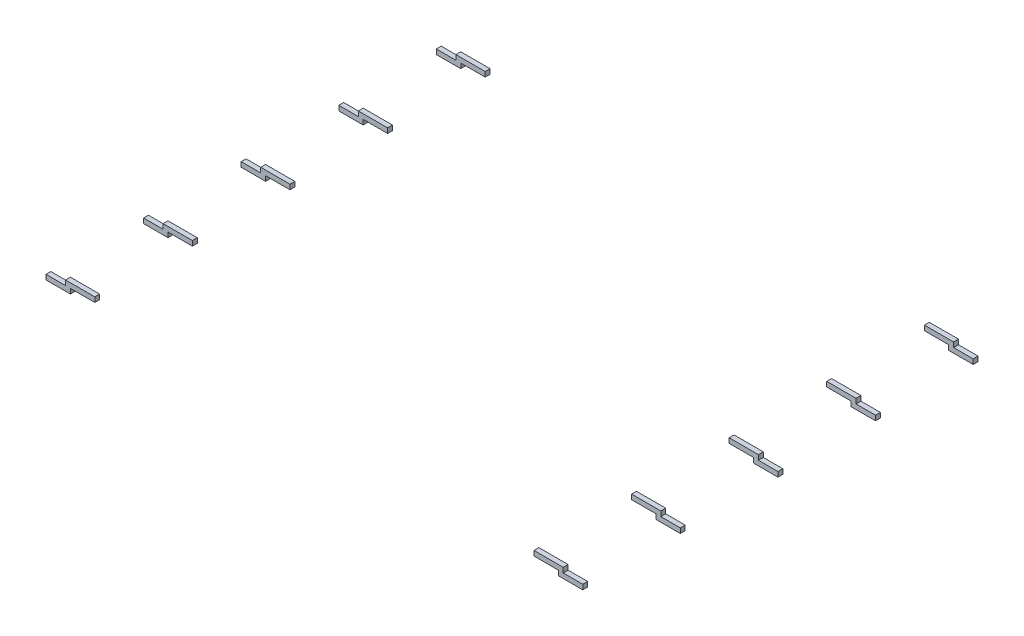
from build123d import *

# Parameters (mm, degrees)
BOSS_EXTRUDE1_DEPTH   = 0.05
BOSS_EXTRUDE1_2_DEPTH = 0.05
LPATTERN1_COUNT       = 5
LPATTERN1_PITCH       = 2


with BuildPart() as part:
    # Sketch1 → Boss-Extrude1 (new, symmetric)
    with BuildSketch(Plane.XY):
        Polygon((5.1, 0), (5.5, 0), (5.5, -0.1), (5, -0.1), (5, 0), (4.5, 0), (4.5, 0.1), (5.1, 0.1), align=None)
    extrude(amount=BOSS_EXTRUDE1_DEPTH, both=True)


with BuildPart() as body_2:
    # Sketch1 → Boss-Extrude1 2 (new, symmetric)
    with BuildSketch(Plane.XY):
        Polygon((-5, 0), (-5, -0.1), (-5.5, -0.1), (-5.5, 0), (-5.1, 0), (-5.1, 0.1), (-4.5, 0.1), (-4.5, 0), align=None)
    extrude(amount=BOSS_EXTRUDE1_2_DEPTH, both=True)


with BuildPart() as lpattern1_1:
    # LPattern1: pattern copy
    add(part.part.moved(Location(Vector(0, 0, 1) * (1 * LPATTERN1_PITCH))))


with BuildPart() as lpattern1_2:
    # LPattern1: pattern copy
    add(part.part.moved(Location(Vector(0, 0, 1) * (2 * LPATTERN1_PITCH))))


with BuildPart() as lpattern1_3:
    # LPattern1: pattern copy
    add(part.part.moved(Location(Vector(0, 0, 1) * (3 * LPATTERN1_PITCH))))


with BuildPart() as lpattern1_4:
    # LPattern1: pattern copy
    add(part.part.moved(Location(Vector(0, 0, 1) * (4 * LPATTERN1_PITCH))))


with BuildPart() as lpattern1_5:
    # LPattern1: pattern copy
    add(body_2.part.moved(Location(Vector(0, 0, 1) * (1 * LPATTERN1_PITCH))))


with BuildPart() as lpattern1_6:
    # LPattern1: pattern copy
    add(body_2.part.moved(Location(Vector(0, 0, 1) * (2 * LPATTERN1_PITCH))))


with BuildPart() as lpattern1_7:
    # LPattern1: pattern copy
    add(body_2.part.moved(Location(Vector(0, 0, 1) * (3 * LPATTERN1_PITCH))))


with BuildPart() as lpattern1_8:
    # LPattern1: pattern copy
    add(body_2.part.moved(Location(Vector(0, 0, 1) * (4 * LPATTERN1_PITCH))))


solid = Compound([part.part, body_2.part, lpattern1_1.part, lpattern1_2.part, lpattern1_3.part, lpattern1_4.part, lpattern1_5.part, lpattern1_6.part, lpattern1_7.part, lpattern1_8.part])
